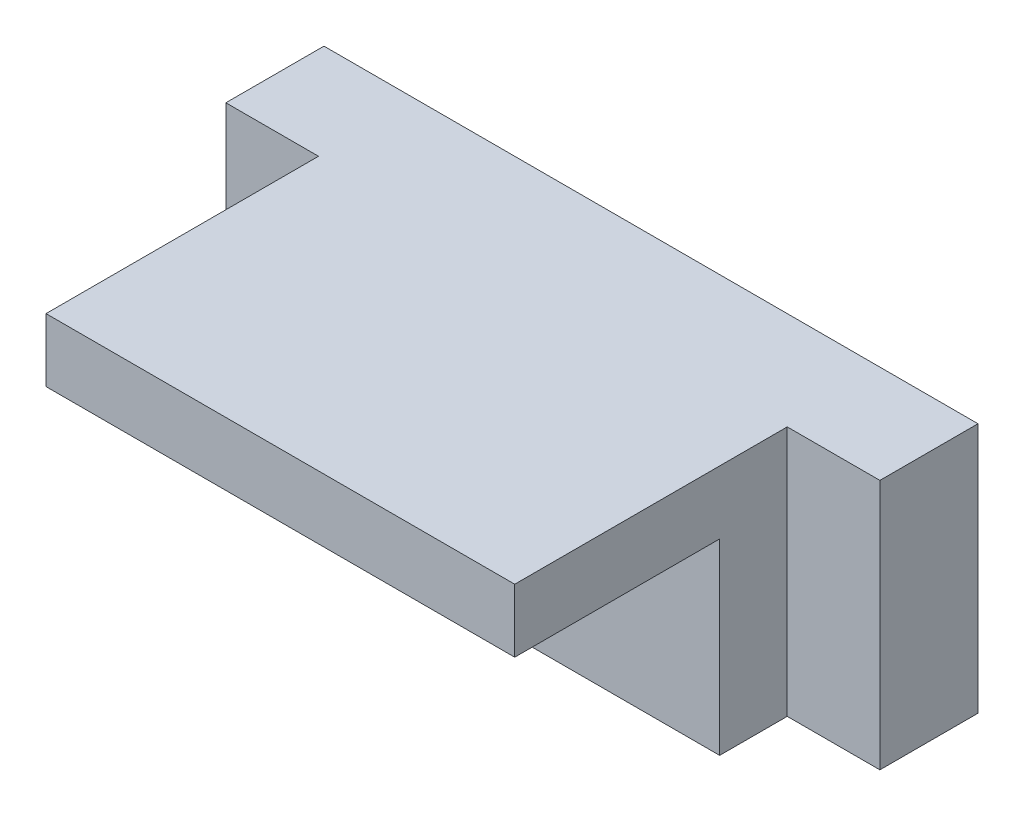
from build123d import *

# Parameters (mm, degrees)
EXTRUDE_1_DEPTH     = 23
SKETCH_2_W          = 18.8
SKETCH_2_H          = 17.2
CUT_EXTRUDE_1_DEPTH = 51


with BuildPart() as part:
    # Эскиз1 → Бобышка-Вытянуть1 (new body)
    with BuildSketch(Plane(origin=(0, 0, 0), x_dir=(1, 0, 0), z_dir=(0, 1, 0))):
        Polygon((-21.5, 0), (21.5, 0), (21.5, 25), (30, 25), (30, 34), (-30, 34), (-30, 25), (-21.5, 25), align=None)
    extrude(amount=EXTRUDE_1_DEPTH)

    # Эскиз2 → Вырез-Вытянуть1 (cut)
    with BuildSketch(Plane(origin=(21.5, 0, 0), x_dir=(0, 0, -1), z_dir=(1, 0, 0))):
        with Locations((9.4, 8.6)):
            Rectangle(SKETCH_2_W, SKETCH_2_H)
    extrude(amount=-CUT_EXTRUDE_1_DEPTH, mode=Mode.SUBTRACT)


solid = part.part
